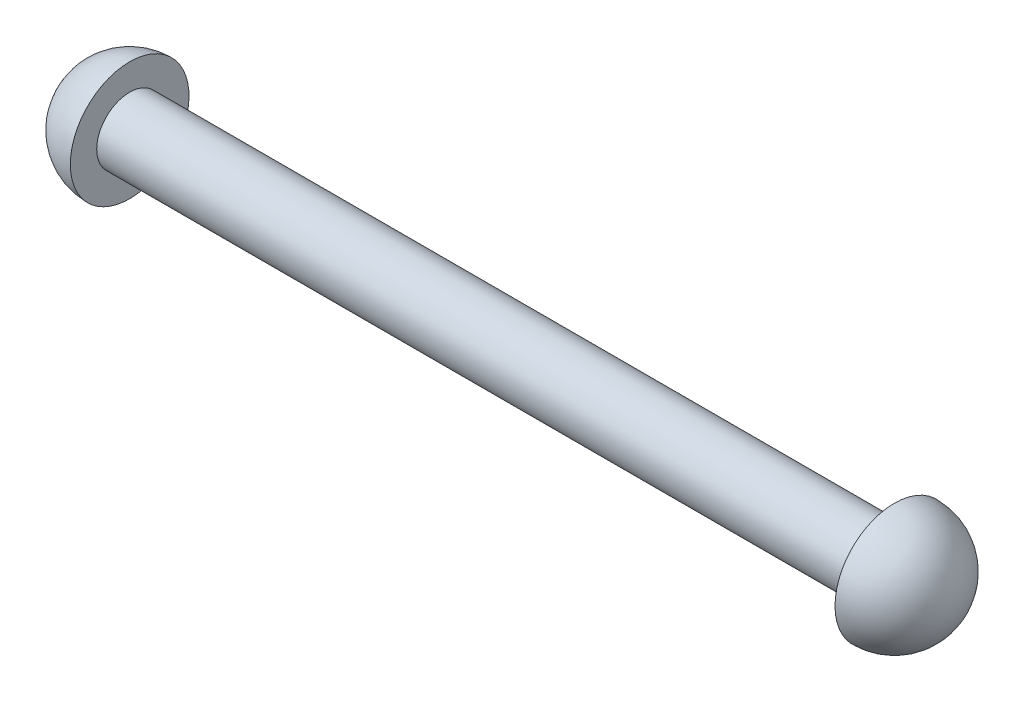
from build123d import *

# Parameters (mm, degrees)
SKETCH1_W = 73.66
SKETCH1_H = 3.175


with BuildPart() as part:
    # Sketch1 → Revolve3 (revolve)
    with BuildSketch(Plane.XY):
        with BuildLine():
            Line((-42.545, 0), (-36.83, 0))
            Line((-36.83, 0), (-36.83, 3.175))
            Line((-36.83, 3.175), (-36.83, 5.715))
            ThreePointArc((-36.83, 5.715), (-40.871115254, 4.041115254), (-42.545, 0))
        make_face()
        with Locations((0, 1.5875)):
            Rectangle(SKETCH1_W, SKETCH1_H)
        with BuildLine():
            Line((36.83, 3.175), (36.83, 0))
            Line((36.83, 0), (42.545, 0))
            ThreePointArc((42.545, 0), (40.871115254, 4.041115254), (36.83, 5.715))
            Line((36.83, 5.715), (36.83, 3.175))
        make_face()
    revolve(axis=Axis((-42.545, 0, 0), (1, 0, 0)))


solid = part.part
